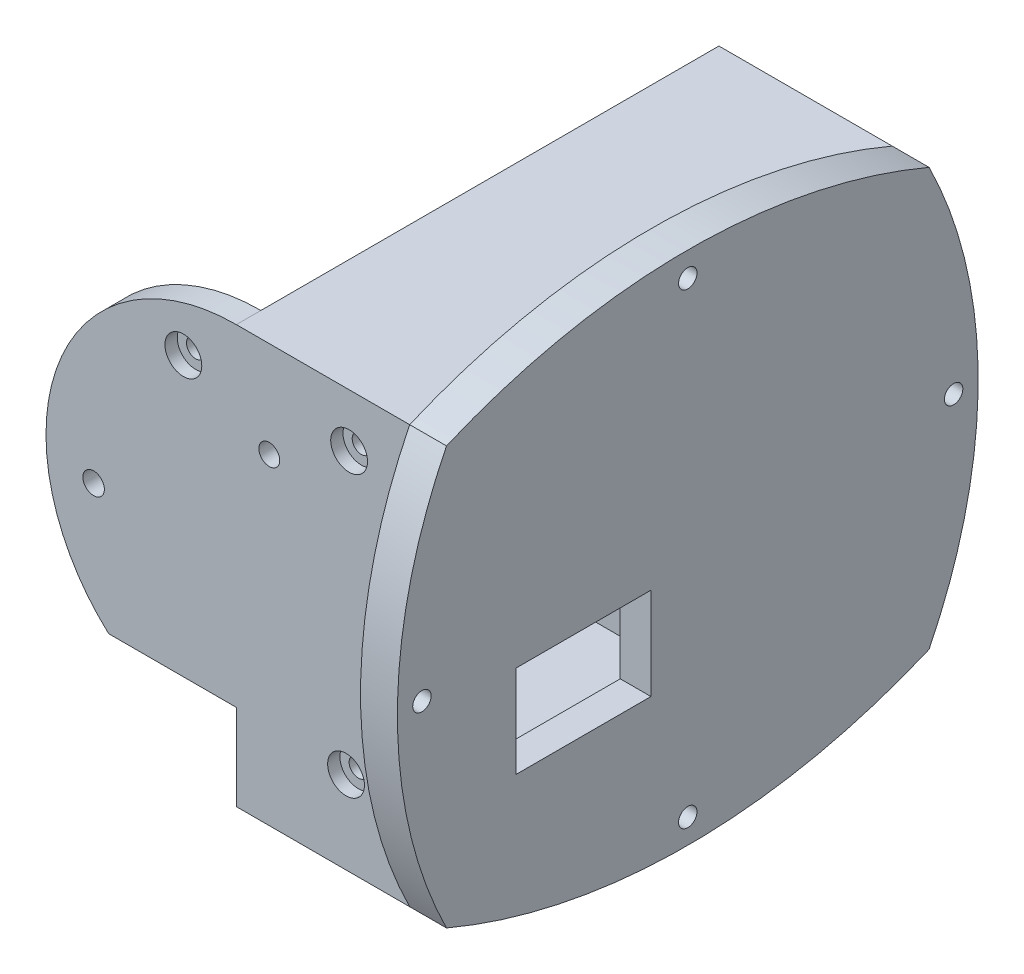
from build123d import *
from build123d.topology import SkipClean

# Parameters (mm, degrees)
BOSS_EXTRUDE1_DEPTH  = 68
CUT_EXTRUDE2_REACH   = 112.532
SKETCH3_R            = 1.7
CUT_EXTRUDE3_REACH   = 112.532
SKETCH4_R            = 4.65
FILLET1_R            = 10
FILLET2_R            = 2
BOSS_EXTRUDE4_REACH  = 109.724
CUT_EXTRUDE11_DEPTH  = 4
SKETCH23_R           = 1.5
CUT_EXTRUDE12_DEPTH  = 4
BOSS_EXTRUDE6_START  = 3.2
SKETCH25_R           = 1.5
BOSS_EXTRUDE6_DEPTH  = 3.2
SKETCH26_R           = 1.75
CUT_EXTRUDE13_DEPTH  = 4
CUT_EXTRUDE14_START  = -4
CUT_EXTRUDE14_DEPTH  = 4
BOSS_EXTRUDE10_START = -4
BOSS_EXTRUDE10_DEPTH = 4
SKETCH28_W           = 9.5
SKETCH28_H           = 4
BOSS_EXTRUDE7_DEPTH  = 14
BOSS_EXTRUDE13_DEPTH = 20
CUT_EXTRUDE16_START  = -10.5
CUT_EXTRUDE16_DEPTH  = 10.5
CUT_EXTRUDE17_START  = -70.6
CUT_EXTRUDE17_DEPTH  = 70.6
SKETCH38_W           = 22
SKETCH38_H           = 15
CUT_EXTRUDE18_DEPTH  = 5
CUT_EXTRUDE19_DEPTH  = 108.723834044
CUT_EXTRUDE22_START  = -3.2
CUT_EXTRUDE22_DEPTH  = 3.2
CUT_EXTRUDE20_START  = -2
SKETCH40_R           = 3
SKETCH40_R_2         = 1.5
CUT_EXTRUDE20_DEPTH  = 2
SKETCH41_R           = 1.5
BOSS_EXTRUDE14_DEPTH = 6
CUT_EXTRUDE21_START  = -2
SKETCH42_R           = 2.75
SKETCH42_R_2         = 1.5
CUT_EXTRUDE21_DEPTH  = 2
FILLET4_R            = 10
CUT_EXTRUDE23_REACH  = 123.206
BOSS_EXTRUDE15_DEPTH = 2.75
BOSS_EXTRUDE16_DEPTH = 2


with BuildPart() as part:
    # Sketch1 → Boss-Extrude1 (new body)
    with BuildSketch(Plane(origin=(0, 0, 0), x_dir=(1, 0, 0), z_dir=(0, 1, 0))):
        Polygon((-37.62, -39.3), (37.62, -39.3), (37.62, 39.3), (-37.62, 39.3), (-37.62, 35.3), (32.62, 35.3), (32.62, -35.3), (-37.62, -35.3), align=None)
    extrude(amount=BOSS_EXTRUDE1_DEPTH)

    # Sketch3 → Cut-Extrude2 (cut, up to next)
    with BuildSketch(Plane.XY.offset(39.3), mode=Mode.PRIVATE) as cut_extrude2_sk1:
        with Locations((8.76, 52.36)):
            Circle(SKETCH3_R)
    cut_extrude2_tool1 = extrude(cut_extrude2_sk1.sketch, amount=-CUT_EXTRUDE2_REACH, mode=Mode.PRIVATE) & part.part
    add(cut_extrude2_tool1.solids().sort_by_distance((8.76, 52.36, 39.3))[0], mode=Mode.SUBTRACT)

    # Sketch4 → Cut-Extrude3 (cut, up to next)
    with BuildSketch(Plane(origin=(0, 0, -39.3), x_dir=(-1, 0, 0), z_dir=(0, 0, -1)), mode=Mode.PRIVATE) as cut_extrude3_sk1:
        with Locations((-8.76, 52.36)):
            Circle(SKETCH4_R)
    cut_extrude3_tool1 = extrude(cut_extrude3_sk1.sketch, amount=-CUT_EXTRUDE3_REACH, mode=Mode.PRIVATE) & part.part
    add(cut_extrude3_tool1.solids().sort_by_distance((8.76, 52.36, -39.3))[0], mode=Mode.SUBTRACT)

    # Fillet1
    fillet1_edges = [part.edges().sort_by_distance(p)[0] for p in [
        (-37.62, 0, 37.3),
        (-37.62, 68, 37.3),
        (-37.62, 68, -37.3),
        (-37.62, 0, -37.3),
    ]]
    fillet(fillet1_edges, radius=FILLET1_R)

    # Fillet2
    fillet2_edges = [part.edges().sort_by_distance(p)[0] for p in [
        (32.62, 34, 35.3),
        (32.62, 34, -35.3),
    ]]
    fillet(fillet2_edges, radius=FILLET2_R)

    # Sketch14 → Boss-Extrude4 (add, up to next)
    with BuildSketch(Plane(origin=(0, 0, 35.3), x_dir=(-1, 0, 0), z_dir=(0, 0, -1)), mode=Mode.PRIVATE) as boss_extrude4_sk1:
        with BuildLine():
            Line((27.62, 68), (-30.62, 68))
            Line((-30.62, 68), (-32.62, 68))
            Line((-32.62, 68), (-32.62, 66))
            Line((-32.62, 66), (32.887826876, 66))
            Line((32.887826876, 66), (32.887826876, 66.5))
            ThreePointArc((32.887826876, 66.5), (30.358612788, 67.617692031), (27.62, 68))
        make_face()
    boss_extrude4_tool1 = extrude(boss_extrude4_sk1.sketch, amount=BOSS_EXTRUDE4_REACH, mode=Mode.PRIVATE) - part.part
    add(boss_extrude4_tool1.solids().sort_by_distance((0.490371, 66.988957, 35.3))[0])

    # Sketch18 → Cut-Extrude11 (cut)
    with BuildSketch(Plane(origin=(0, 0, -39.3), x_dir=(-1, 0, 0), z_dir=(0, 0, -1))):
        with BuildLine():
            ThreePointArc((37.62, 45.200981905), (30.000066086, 52.387776103), (19.856610561, 55))
            ThreePointArc((19.856610561, 55), (-1.143389439, 34), (19.856610561, 13))
            ThreePointArc((19.856610561, 13), (30.000066086, 15.612223897), (37.62, 22.799018095))
            Line((37.62, 22.799018095), (37.62, 45.200981905))
        make_face()
        with BuildLine():
            ThreePointArc((40.856610561, 34), (40.031237921, 39.829614986), (37.62, 45.200981905))
            Line((37.62, 45.200981905), (37.62, 22.799018095))
            ThreePointArc((37.62, 22.799018095), (40.031237921, 28.170385014), (40.856610561, 34))
        make_face()
        with BuildLine():
            Line((37.62, 55), (27.62, 55))
            Line((27.62, 55), (19.856610561, 55))
            ThreePointArc((19.856610561, 55), (30.000066086, 52.387776103), (37.62, 45.200981905))
            Line((37.62, 45.200981905), (37.62, 55))
        make_face()
        with BuildLine():
            ThreePointArc((37.62, 22.799018095), (30.000066086, 15.612223897), (19.856610561, 13))
            Line((19.856610561, 13), (27.62, 13))
            Line((27.62, 13), (37.62, 13))
            Line((37.62, 13), (37.62, 22.799018095))
        make_face()
    extrude(amount=-CUT_EXTRUDE11_DEPTH, mode=Mode.SUBTRACT)

    # Sketch23 → Cut-Extrude12 (cut)
    with BuildSketch(Plane(origin=(0, 0, 35.3), x_dir=(-1, 0, 0), z_dir=(0, 0, -1))):
        with Locations((5.24, 59.36)):
            Circle(SKETCH23_R)
        with Locations(Location((-21.26, 13.46, 0), (0, 0, 180))):
            Circle(SKETCH23_R)
        with Locations(Location((-21.76, 59.36, 0), (0, 0, 180))):
            Circle(SKETCH23_R)
    extrude(amount=-CUT_EXTRUDE12_DEPTH, mode=Mode.SUBTRACT)

    # Sketch25 → Boss-Extrude6 (add)
    # profile 1 of 2: a face of its own
    with BuildSketch(Plane(origin=(0, 0, 35.3), x_dir=(-1, 0, 0), z_dir=(0, 0, -1)).offset(BOSS_EXTRUDE6_START)):
        with BuildLine():
            Line((3.477090397, 21.127961613), (3.477089964, 38.557947619))
            add(Edge.make_bspline(
                [(3.477089601, 53.162052774), (3.70783766, 52.97910165), (3.930820512, 52.784505759), (4.394269372, 52.338916291), (4.631161685, 52.08455787), (5.297503135, 51.283019331), (5.682102728, 50.697318432), (6.150368537, 49.776191766), (6.289282521, 49.461545189), (6.5353756, 48.805378296), (6.642921622, 48.462625677), (6.908675923, 47.392141185), (7.006302097, 46.625482323), (7.006055781, 45.091524518), (6.90818799, 44.325160558), (6.64235472, 43.25545942), (6.534833658, 42.913021776), (6.28879699, 42.257316021), (6.149897504, 41.942792099), (5.681517262, 41.021713961), (5.296724939, 40.435906371), (4.630414223, 39.634612268), (4.393573234, 39.38037341), (3.930376688, 38.935103193), (3.707583612, 38.740697206), (3.477089964, 38.557947619)],
                knots=[0.008416085, 0.008416085, 0.008416085, 0.008416085, 0.0625, 0.0625, 0.125, 0.125, 0.25, 0.25, 0.3125, 0.3125, 0.375, 0.375, 0.5, 0.5, 0.625, 0.625, 0.6875, 0.6875, 0.75, 0.75, 0.875, 0.875, 0.9375, 0.9375, 0.991575633, 0.991575633, 0.991575633, 0.991575633], degree=3))
            Line((3.477089601, 53.162052774), (3.47708943, 60.053943549))
            add(Edge.make_bspline(
                [(3.47708943, 60.053943549), (3.480843911, 60.153520079), (3.483981738, 60.265495199), (3.476481681, 60.482732832), (3.468269549, 60.589859532), (3.429196291, 60.912720436), (3.384300353, 61.125636569), (3.237565019, 61.603824056), (3.122516093, 61.865394671), (2.97708943, 62.11)],
                knots=[0, 0, 0, 0, 0.0625, 0.0625, 0.125, 0.125, 0.25, 0.25, 0.412651833, 0.412651833, 0.412651833, 0.412651833], degree=3))
            Line((2.97708943, 62.11), (6.905314267, 62.11))
            add(Edge.make_bspline(
                [(8.205054445, 58.946437626), (8.205009501, 59.244795054), (8.176273565, 59.534975837), (8.061538834, 60.110580612), (7.975375467, 60.395609607), (7.640800905, 61.204621513), (7.313331595, 61.697224443), (6.905314267, 62.11)],
                knots=[0, 0, 0, 0, 0.125, 0.125, 0.25, 0.25, 0.496295227, 0.496295227, 0.496295227, 0.496295227], degree=3))
            Line((8.205054445, 58.946437626), (8.205054436, 12.016062165))
            add(Edge.make_bspline(
                [(6.705009743, 10.516138304), (6.805433587, 10.516162579), (6.901279971, 10.525667111), (7.091888196, 10.563659973), (7.187383869, 10.592536201), (7.461135653, 10.7055156), (7.62654513, 10.816287079), (7.905133635, 11.094946348), (8.015789093, 11.26026509), (8.128713728, 11.534010454), (8.157579409, 11.629507931), (8.195537816, 11.81999828), (8.205026979, 11.915747096), (8.205054436, 12.016062165)],
                knots=[0, 0, 0, 0, 0.125, 0.125, 0.25, 0.25, 0.5, 0.5, 0.75, 0.75, 0.875, 0.875, 1, 1, 1, 1], degree=3))
            Line((6.705009743, 10.516138304), (0.196303306, 10.516138304))
            Line((0.196303306, 10.516138304), (0.196303306, 15.733506859))
            add(Edge.make_bspline(
                [(3.482525603, 19.034267812), (3.481148134, 18.937045402), (3.477899271, 18.824719912), (3.457254863, 18.611890418), (3.442089278, 18.50630055), (3.380754217, 18.191274466), (3.319507228, 17.985267869), (3.076942548, 17.389364042), (2.835907963, 17.02201721), (2.228858089, 16.40640163), (1.862339364, 16.157860958), (1.260574846, 15.90535442), (1.050604051, 15.841381376), (0.732046743, 15.77670991), (0.623541429, 15.759683248), (0.401446925, 15.739063849), (0.295419477, 15.736276163), (0.196303306, 15.733506859)],
                knots=[0, 0, 0, 0, 0.0625, 0.0625, 0.125, 0.125, 0.25, 0.25, 0.5, 0.5, 0.75, 0.75, 0.875, 0.875, 0.9375, 0.9375, 1, 1, 1, 1], degree=3))
            Line((3.482525603, 19.034267812), (3.477090397, 21.127961613))
        make_face()
        with Locations(Location((4.74, 13.46, 0), (0, 0, 180))):
            Circle(SKETCH25_R, mode=Mode.SUBTRACT)
        with Locations(Location((5.24, 59.36, 0), (0, 0, 180))):
            Circle(SKETCH25_R, mode=Mode.SUBTRACT)
    # profile 2 of 2: a face of its own
    with BuildSketch(Plane(origin=(0, 0, 35.3), x_dir=(-1, 0, 0), z_dir=(0, 0, -1)).offset(BOSS_EXTRUDE6_START)):
        with BuildLine():
            Line((-19.997090397, 21.127961613), (-20.002525603, 19.034267812))
            add(Edge.make_bspline(
                [(-20.002525603, 19.034267812), (-20.001148134, 18.937045402), (-19.997899271, 18.824719912), (-19.977254863, 18.611890418), (-19.962089278, 18.50630055), (-19.900754217, 18.191274466), (-19.839507228, 17.985267869), (-19.596942548, 17.389364042), (-19.355907963, 17.02201721), (-18.748858089, 16.40640163), (-18.382339364, 16.157860958), (-17.780574846, 15.90535442), (-17.570604051, 15.841381376), (-17.252046743, 15.77670991), (-17.143541429, 15.759683248), (-16.921446925, 15.739063849), (-16.815419477, 15.736276163), (-16.716303306, 15.733506859)],
                knots=[0, 0, 0, 0, 0.0625, 0.0625, 0.125, 0.125, 0.25, 0.25, 0.5, 0.5, 0.75, 0.75, 0.875, 0.875, 0.9375, 0.9375, 1, 1, 1, 1], degree=3))
            Line((-16.716303306, 15.733506859), (-16.716303306, 10.516138304))
            Line((-16.716303306, 10.516138304), (-23.225009743, 10.516138304))
            add(Edge.make_bspline(
                [(-23.225009743, 10.516138304), (-23.325433587, 10.516162579), (-23.421279971, 10.525667111), (-23.611888196, 10.563659973), (-23.707383869, 10.592536201), (-23.981135653, 10.7055156), (-24.14654513, 10.816287079), (-24.425133635, 11.094946348), (-24.535789093, 11.26026509), (-24.648713728, 11.534010454), (-24.677579409, 11.629507931), (-24.715537816, 11.81999828), (-24.725026979, 11.915747096), (-24.72505445, 12.016062165)],
                knots=[0, 0, 0, 0, 0.125, 0.125, 0.25, 0.25, 0.5, 0.5, 0.75, 0.75, 0.875, 0.875, 1, 1, 1, 1], degree=3))
            Line((-24.72505445, 12.016062165), (-24.72505445, 58.946437605))
            add(Edge.make_bspline(
                [(-24.72505445, 58.946437605), (-24.725009501, 59.244795054), (-24.696273565, 59.534975837), (-24.581538834, 60.110580612), (-24.495375467, 60.395609607), (-24.160800905, 61.204621513), (-23.833331595, 61.697224443), (-23.425314267, 62.11)],
                knots=[0, 0, 0, 0, 0.125, 0.125, 0.25, 0.25, 0.496295227, 0.496295227, 0.496295227, 0.496295227], degree=3))
            Line((-23.425314267, 62.11), (-19.49708943, 62.11))
            add(Edge.make_bspline(
                [(-19.99708943, 60.053943549), (-20.000843911, 60.153520079), (-20.003981738, 60.265495199), (-19.996481681, 60.482732832), (-19.988269549, 60.589859532), (-19.949196291, 60.912720436), (-19.904300353, 61.125636569), (-19.757565019, 61.603824056), (-19.642516093, 61.865394671), (-19.49708943, 62.11)],
                knots=[0, 0, 0, 0, 0.0625, 0.0625, 0.125, 0.125, 0.25, 0.25, 0.412651833, 0.412651833, 0.412651833, 0.412651833], degree=3))
            Line((-19.99708943, 60.053943549), (-19.997089601, 53.162052774))
            add(Edge.make_bspline(
                [(-19.997089601, 53.162052774), (-20.22783766, 52.97910165), (-20.450820512, 52.784505759), (-20.914269372, 52.338916291), (-21.151161685, 52.08455787), (-21.817503135, 51.283019331), (-22.202102728, 50.697318432), (-22.670368537, 49.776191766), (-22.809282521, 49.461545189), (-23.0553756, 48.805378296), (-23.162921622, 48.462625677), (-23.428675923, 47.392141185), (-23.526302097, 46.625482323), (-23.526055781, 45.091524518), (-23.42818799, 44.325160558), (-23.16235472, 43.25545942), (-23.054833658, 42.913021776), (-22.80879699, 42.257316021), (-22.669897504, 41.942792099), (-22.201517262, 41.021713961), (-21.816724939, 40.435906371), (-21.150414223, 39.634612268), (-20.913573234, 39.38037341), (-20.450376688, 38.935103193), (-20.227583612, 38.740697206), (-19.997089964, 38.557947619)],
                knots=[0.008416085, 0.008416085, 0.008416085, 0.008416085, 0.0625, 0.0625, 0.125, 0.125, 0.25, 0.25, 0.3125, 0.3125, 0.375, 0.375, 0.5, 0.5, 0.625, 0.625, 0.6875, 0.6875, 0.75, 0.75, 0.875, 0.875, 0.9375, 0.9375, 0.991575633, 0.991575633, 0.991575633, 0.991575633], degree=3))
            Line((-19.997089964, 38.557947619), (-19.997090397, 21.127961613))
        make_face()
        with Locations((-21.76, 59.36)):
            Circle(SKETCH25_R, mode=Mode.SUBTRACT)
        with Locations((-21.26, 13.46)):
            Circle(SKETCH25_R, mode=Mode.SUBTRACT)
    extrude(amount=-BOSS_EXTRUDE6_DEPTH)

    # Sketch26 → Cut-Extrude13 (cut)
    with BuildSketch(Plane.XY.offset(39.3)):
        with Locations((-19.856610561, 34)):
            Circle(SKETCH26_R)
    extrude(amount=-CUT_EXTRUDE13_DEPTH, mode=Mode.SUBTRACT)

    # Sketch27 → Cut-Extrude14 (cut)
    with BuildSketch(Plane(origin=(0, 0, -39.3), x_dir=(-1, 0, 0), z_dir=(0, 0, -1)).offset(CUT_EXTRUDE14_START)):
        with BuildLine():
            Line((37.62, 55), (37.62, 58))
            ThreePointArc((37.62, 58), (34.691067812, 65.071067812), (27.62, 68))
            Line((27.62, 68), (-3.393389439, 68))
            Line((-3.393389439, 68), (-3.393389439, 45))
            Line((-3.393389439, 45), (-3.393389439, 34))
            Line((-3.393389439, 34), (-1.143389439, 34))
            ThreePointArc((-1.143389439, 34), (5.007368156, 48.849242405), (19.856610561, 55))
            Line((19.856610561, 55), (37.62, 55))
        make_face()
        with BuildLine():
            Line((-3.393389439, 15), (-3.393389439, 34))
            Line((-3.393389439, 34), (-7.126648347, 34))
            ThreePointArc((-7.126648347, 34), (-6.828181716, 24.191875904), (-3.393389439, 15))
        make_face()
        with BuildLine():
            ThreePointArc((19.856610561, 13), (5.007368156, 19.150757595), (-1.143389439, 34))
            Line((-1.143389439, 34), (-3.393389439, 34))
            Line((-3.393389439, 34), (-3.393389439, 15))
            Line((-3.393389439, 15), (-3.393389439, 0))
            Line((-3.393389439, 0), (27.62, 0))
            ThreePointArc((27.62, 0), (34.691067812, 2.928932188), (37.62, 10))
            Line((37.62, 10), (37.62, 13))
            Line((37.62, 13), (19.856610561, 13))
        make_face()
        with BuildLine():
            Line((-3.393389439, 34), (-3.393389439, 45))
            ThreePointArc((-3.393389439, 45), (-5.795242043, 39.681647872), (-7.126648347, 34))
            Line((-7.126648347, 34), (-3.393389439, 34))
        make_face()
    extrude(amount=CUT_EXTRUDE14_DEPTH, mode=Mode.SUBTRACT)

    # Sketch33 → Boss-Extrude10 (add)
    with BuildSketch(Plane.XZ.offset(BOSS_EXTRUDE10_START)):
        with BuildLine():
            Line((3.393389439, 35.3), (30.62, 35.3))
            ThreePointArc((30.62, 35.3), (32.034213562, 34.714213562), (32.62, 33.3))
            Line((32.62, 33.3), (32.62, -33.3))
            ThreePointArc((32.62, -33.3), (32.034213562, -34.714213562), (30.62, -35.3))
            Line((30.62, -35.3), (3.393389439, -35.3))
            Line((3.393389439, -35.3), (3.393389439, 35.3))
        make_face()
    extrude(amount=BOSS_EXTRUDE10_DEPTH)

    # Sketch28 → Boss-Extrude7 (add)
    with BuildSketch(Plane.ZY.offset(-3.393389439)):
        with Locations((-16.75, 2)):
            Rectangle(SKETCH28_W, SKETCH28_H)
    extrude(amount=BOSS_EXTRUDE7_DEPTH)

    # Sketch35 → Boss-Extrude13 (add)
    with BuildSketch(Plane.XY.offset(-12)):
        with BuildLine():
            Line((-24.339016712, 31.784591437), (-10.606610561, 4))
            Line((-10.606610561, 4), (32.62, 4))
            Line((32.62, 4), (-14.856610561, 34))
            ThreePointArc((-14.856610561, 34), (-20.99414501, 38.868882354), (-24.339016712, 31.784591437))
        make_face()
    extrude(amount=-BOSS_EXTRUDE13_DEPTH)

    # Sketch36 → Cut-Extrude16 (cut)
    with BuildSketch(Plane(origin=(0, 0, -32), x_dir=(-1, 0, 0), z_dir=(0, 0, -1)).offset(CUT_EXTRUDE16_START)):
        with BuildLine():
            Line((-32.62, 4), (10.606610561, 4))
            Line((10.606610561, 4), (24.339016712, 31.784591437))
            ThreePointArc((24.339016712, 31.784591437), (18.719076112, 29.131117646), (14.856610561, 34))
            Line((14.856610561, 34), (-32.62, 4))
        make_face()
    extrude(amount=CUT_EXTRUDE16_DEPTH, mode=Mode.SUBTRACT)

    # Sketch37 → Cut-Extrude17 (cut)
    with BuildSketch(Plane(origin=(0, 0, -35.3), x_dir=(-1, 0, 0), z_dir=(0, 0, -1)).offset(CUT_EXTRUDE17_START)):
        with BuildLine():
            Line((32.887826876, 66), (32.887826876, 66.5))
            ThreePointArc((32.887826876, 66.5), (30.358612788, 67.617692031), (27.62, 68))
            Line((27.62, 68), (-3.393389439, 68))
            Line((-3.393389439, 68), (-3.393389439, 66))
            Line((-3.393389439, 66), (32.887826876, 66))
        make_face()
    extrude(amount=CUT_EXTRUDE17_DEPTH, mode=Mode.SUBTRACT)

    # Sketch38 → Cut-Extrude18 (cut)
    with BuildSketch(Plane(origin=(37.62, 0, 0), x_dir=(0, 0, -1), z_dir=(1, 0, 0))):
        with Locations((-17, 23.5)):
            Rectangle(SKETCH38_W, SKETCH38_H)
    extrude(amount=-CUT_EXTRUDE18_DEPTH, mode=Mode.SUBTRACT)

    # Sketch39 → Cut-Extrude19 (cut, through all)
    with BuildSketch(Plane(origin=(0, 0, 35.3), x_dir=(-1, 0, 0), z_dir=(0, 0, -1))):
        with BuildLine():
            ThreePointArc((12.98556057, 10.663098201), (31.047779298, 29.639516629), (37.62, 55))
            Line((37.62, 55), (37.62, 58))
            ThreePointArc((37.62, 58), (34.691067812, 65.071067812), (27.62, 68))
            Line((27.62, 68), (-3.393389439, 68))
            ThreePointArc((-3.393389439, 68), (25.541234637, 48.1400223), (17.411655184, 14))
            ThreePointArc((17.411655184, 14), (15.273321374, 12.232448489), (12.98556057, 10.663098201))
        make_face()
        with BuildLine():
            Line((37.62, 10), (37.62, 55))
            ThreePointArc((37.62, 55), (31.047779298, 29.639516629), (12.98556057, 10.663098201))
            ThreePointArc((12.98556057, 10.663098201), (5.080185766, 6.63318584), (-3.393389439, 4))
            Line((-3.393389439, 4), (-3.393389439, 0))
            Line((-3.393389439, 0), (27.62, 0))
            ThreePointArc((27.62, 0), (34.691067812, 2.928932188), (37.62, 10))
        make_face()
        with BuildLine():
            ThreePointArc((-3.393389439, 4), (5.080185766, 6.63318584), (12.98556057, 10.663098201))
            ThreePointArc((12.98556057, 10.663098201), (15.273321374, 12.232448489), (17.411655184, 14))
            Line((17.411655184, 14), (-3.393389439, 14))
            Line((-3.393389439, 14), (-3.393389439, 4))
        make_face()
    extrude(amount=-CUT_EXTRUDE19_DEPTH, mode=Mode.SUBTRACT)

    # Sketch43 → Cut-Extrude22 (cut)
    with BuildSketch(Plane.XY.offset(35.3).offset(CUT_EXTRUDE22_START)):
        with BuildLine():
            Line((-6.139428455, 14), (-8.205054437, 14))
            Line((-8.205054437, 14), (-8.205054436, 12.016062165))
            add(Edge.make_bspline(
                [(-8.205054436, 12.016062165), (-8.205026979, 11.915747096), (-8.195537816, 11.81999828), (-8.157579409, 11.629507931), (-8.128713728, 11.534010454), (-8.015789093, 11.26026509), (-7.905133635, 11.094946348), (-7.62654513, 10.816287079), (-7.461135653, 10.7055156), (-7.187383869, 10.592536201), (-7.091888196, 10.563659973), (-6.901279971, 10.525667111), (-6.805433587, 10.516162579), (-6.705009743, 10.516138304)],
                knots=[0, 0, 0, 0, 0.125, 0.125, 0.25, 0.25, 0.5, 0.5, 0.75, 0.75, 0.875, 0.875, 1, 1, 1, 1], degree=3))
            Line((-6.705009743, 10.516138304), (-0.196303306, 10.516138304))
            Line((-0.196303306, 10.516138304), (-0.196303306, 14))
            Line((-0.196303306, 14), (-3.340571545, 14))
            ThreePointArc((-3.340571545, 14), (-4.74, 11.96), (-6.139428455, 14))
        make_face()
    extrude(amount=CUT_EXTRUDE22_DEPTH, mode=Mode.SUBTRACT)

    # Sketch40 → Cut-Extrude20 (cut)
    # profile 1 of 3: a face of its own
    with BuildSketch(Plane.XY.offset(39.3).offset(CUT_EXTRUDE20_START)):
        with Locations((-5.24, 59.36)):
            Circle(SKETCH40_R)
        with Locations((-5.24, 59.36)):
            Circle(SKETCH40_R_2, mode=Mode.SUBTRACT)
    # profile 2 of 3: a face of its own
    with BuildSketch(Plane.XY.offset(39.3).offset(CUT_EXTRUDE20_START)):
        with Locations((21.76, 59.36)):
            Circle(SKETCH40_R)
        with Locations(Location((21.76, 59.36, 0), (0, 0, 180))):
            Circle(SKETCH40_R_2, mode=Mode.SUBTRACT)
    # profile 3 of 3: a face of its own
    with BuildSketch(Plane.XY.offset(39.3).offset(CUT_EXTRUDE20_START)):
        with Locations((21.26, 13.46)):
            Circle(SKETCH40_R)
        with Locations(Location((21.26, 13.46, 0), (0, 0, 180))):
            Circle(SKETCH40_R_2, mode=Mode.SUBTRACT)
    extrude(amount=CUT_EXTRUDE20_DEPTH, mode=Mode.SUBTRACT)

    # Sketch41 → Boss-Extrude14 (add)
    # profile 1 of 4: a face of its own
    with BuildSketch(Plane(origin=(37.62, 0, 0), x_dir=(0, 0, -1), z_dir=(1, 0, 0))):
        with BuildLine():
            ThreePointArc((39.3, 0), (47.3, 34), (39.3, 68))
            Line((39.3, 68), (39.3, 0))
        make_face()
        with Locations((43.3, 34)):
            Circle(SKETCH41_R, mode=Mode.SUBTRACT)
    # profile 2 of 4: a face of its own
    with BuildSketch(Plane(origin=(37.62, 0, 0), x_dir=(0, 0, -1), z_dir=(1, 0, 0))):
        with BuildLine():
            Line((-39.3, 68), (39.3, 68))
            ThreePointArc((39.3, 68), (0, 76), (-39.3, 68))
        make_face()
        with Locations((0, 72)):
            Circle(SKETCH41_R, mode=Mode.SUBTRACT)
    # profile 3 of 4: a face of its own
    with BuildSketch(Plane(origin=(37.62, 0, 0), x_dir=(0, 0, -1), z_dir=(1, 0, 0))):
        with BuildLine():
            ThreePointArc((-39.3, 0), (0, -8), (39.3, 0))
            Line((39.3, 0), (-39.3, 0))
        make_face()
        with Locations((0, -4)):
            Circle(SKETCH41_R, mode=Mode.SUBTRACT)
    # profile 4 of 4: a face of its own
    with BuildSketch(Plane(origin=(37.62, 0, 0), x_dir=(0, 0, -1), z_dir=(1, 0, 0))):
        with BuildLine():
            Line((-39.3, 0), (-39.3, 68))
            ThreePointArc((-39.3, 68), (-47.3, 34), (-39.3, 0))
        make_face()
        with Locations((-43.3, 34)):
            Circle(SKETCH41_R, mode=Mode.SUBTRACT)
    extrude(amount=-BOSS_EXTRUDE14_DEPTH)

    # Sketch42 → Cut-Extrude21 (cut)
    # profile 1 of 4: a face of its own
    with BuildSketch(Plane.ZY.offset(-31.62).offset(CUT_EXTRUDE21_START)):
        with Locations((0, 72)):
            Circle(SKETCH42_R)
        with Locations(Location((0, 72, 0), (0, 0, 180))):
            Circle(SKETCH42_R_2, mode=Mode.SUBTRACT)
    # profile 2 of 4: a face of its own
    with BuildSketch(Plane.ZY.offset(-31.62).offset(CUT_EXTRUDE21_START)):
        with Locations((-43.3, 34)):
            Circle(SKETCH42_R)
        with Locations(Location((-43.3, 34, 0), (0, 0, 180))):
            Circle(SKETCH42_R_2, mode=Mode.SUBTRACT)
    # profile 3 of 4: a face of its own
    with BuildSketch(Plane.ZY.offset(-31.62).offset(CUT_EXTRUDE21_START)):
        with Locations((0, -4)):
            Circle(SKETCH42_R)
        with Locations(Location((0, -4, 0), (0, 0, 180))):
            Circle(SKETCH42_R_2, mode=Mode.SUBTRACT)
    # profile 4 of 4: a face of its own
    with BuildSketch(Plane.ZY.offset(-31.62).offset(CUT_EXTRUDE21_START)):
        with Locations((43.3, 34)):
            Circle(SKETCH42_R)
        with Locations(Location((43.3, 34, 0), (0, 0, 180))):
            Circle(SKETCH42_R_2, mode=Mode.SUBTRACT)
    extrude(amount=CUT_EXTRUDE21_DEPTH, mode=Mode.SUBTRACT)

    # Fillet4
    fillet4_edges = [part.edges().sort_by_distance(p)[0] for p in [
        (3.393389439, 2, -12),
        (3.393389439, 2, -21.5),
    ]]
    fillet(fillet4_edges, radius=FILLET4_R)

    # Sketch44 → Cut-Extrude23 (cut, up to next)
    with BuildSketch(Plane(origin=(0, 0, -39.3), x_dir=(-1, 0, 0), z_dir=(0, 0, -1)), mode=Mode.PRIVATE) as cut_extrude23_sk1:
        with BuildLine():
            Line((-8.76, 60.36), (-3.393389439, 60.36))
            Line((-3.393389439, 60.36), (-3.393389439, 44.36))
            Line((-3.393389439, 44.36), (-8.76, 44.36))
            ThreePointArc((-8.76, 44.36), (-16.76, 52.36), (-8.76, 60.36))
        make_face()
    cut_extrude23_tool1 = extrude(cut_extrude23_sk1.sketch, amount=-CUT_EXTRUDE23_REACH, mode=Mode.PRIVATE) & part.part
    add(cut_extrude23_tool1.solids().sort_by_distance((9.355124, 52.36, -39.3))[0], mode=Mode.SUBTRACT)

    # Sketch45 → Boss-Extrude15 (add)
    with BuildSketch(Plane(origin=(0, 0, -39.3), x_dir=(-1, 0, 0), z_dir=(0, 0, -1))):
        with BuildLine():
            Line((-8.76, 44.36), (-3.750572601, 44.36))
            ThreePointArc((-3.750572601, 44.36), (-4.264329377, 43.369175437), (-4.74103083, 42.36))
            Line((-4.74103083, 42.36), (-8.76, 42.36))
            ThreePointArc((-8.76, 42.36), (-18.76, 52.36), (-8.76, 62.36))
            Line((-8.76, 62.36), (-3.393389439, 62.36))
            Line((-3.393389439, 62.36), (-3.393389439, 60.36))
            Line((-3.393389439, 60.36), (-8.76, 60.36))
            ThreePointArc((-8.76, 60.36), (-16.76, 52.36), (-8.76, 44.36))
        make_face()
    extrude(amount=BOSS_EXTRUDE15_DEPTH)

    # Sketch46 → Boss-Extrude16 (add)
    with SkipClean():  # the faces are left unmerged after this step: merging them gives an invalid solid
        with BuildSketch(Plane(origin=(0, 0, -42.05), x_dir=(-1, 0, 0), z_dir=(0, 0, -1))):
            with BuildLine():
                Line((-3.750572601, 44.36), (-3.393389439, 60.36))
                Line((-3.393389439, 60.36), (-3.393389439, 62.36))
                Line((-3.393389439, 62.36), (-8.76, 62.36))
                ThreePointArc((-8.76, 62.36), (-18.76, 52.36), (-8.76, 42.36))
                Line((-8.76, 42.36), (-4.74103083, 42.36))
                ThreePointArc((-4.74103083, 42.36), (-4.264329377, 43.369175437), (-3.750572601, 44.36))
            make_face()
        extrude(amount=BOSS_EXTRUDE16_DEPTH)


solid = part.part
